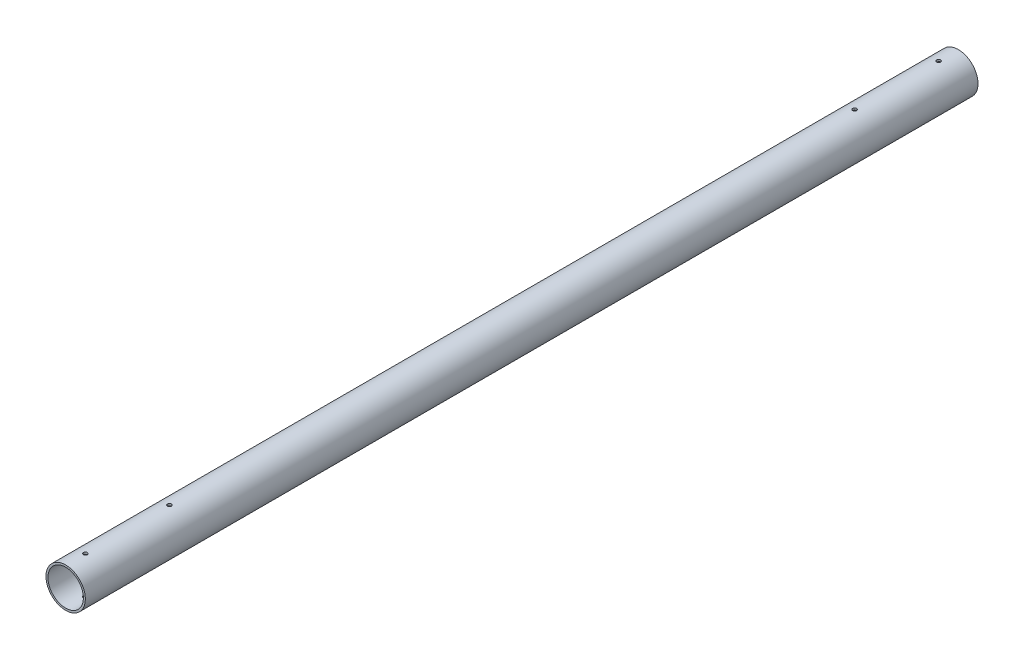
from build123d import *

# Parameters (mm, degrees)
SKETCH1_R               = 15
BOSS_EXTRUDE1_DEPTH     = 680
SKETCH2_R               = 13.5
CUT_EXTRUDE1_DEPTH      = 681.33080189
CUT_EXTRUDE2_DEPTH      = 681.33080189
CUT_EXTRUDE2_DEPTH_BACK = 681.33080189
SKETCH3_R               = 1.5


with BuildPart() as part:
    # Sketch1 → Boss-Extrude1 (new body)
    with BuildSketch(Plane.XY):
        Circle(SKETCH1_R)
    extrude(amount=BOSS_EXTRUDE1_DEPTH)

    # Sketch2 → Cut-Extrude1 (cut, through all)
    with BuildSketch(Plane(origin=(0, 0, 0), x_dir=(-1, 0, 0), z_dir=(0, 0, -1))):
        Circle(SKETCH2_R)
    extrude(amount=-CUT_EXTRUDE1_DEPTH, mode=Mode.SUBTRACT)

    # Sketch3 → Cut-Extrude2 (cut, two sides: drawn at the far end of the back side and taken through both)
    with BuildSketch(Plane(origin=(0, 0, 0), x_dir=(1, 0, 0), z_dir=(0, 1, 0)).offset(-CUT_EXTRUDE2_DEPTH_BACK)):
        with Locations(Location((0, -15, 0), (0, 0, 270))):
            Circle(SKETCH3_R)
        with Locations(Location((0, -665, 0), (0, 0, 270))):
            Circle(SKETCH3_R)
        with Locations(Location((0, -79, 0), (0, 0, 270))):
            Circle(SKETCH3_R)
        with Locations(Location((0, -601, 0), (0, 0, 270))):
            Circle(SKETCH3_R)
    extrude(amount=CUT_EXTRUDE2_DEPTH + CUT_EXTRUDE2_DEPTH_BACK, mode=Mode.SUBTRACT)


solid = part.part
